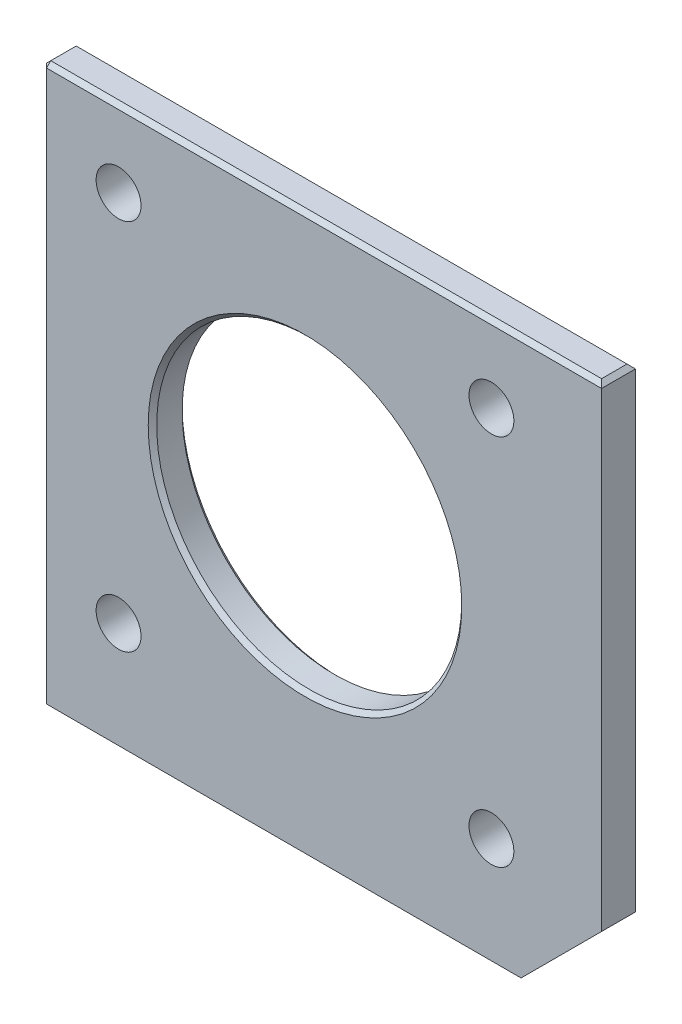
from build123d import *

# Parameters (mm, degrees)
ESQUISSE1_W        = 66
ESQUISSE1_H        = 66
ESQUISSE1_R        = 18
BOSS_EXTRU_1_DEPTH = 4
CHANFREIN1_SIZE    = 10
CHANFREIN2_SIZE    = 0.5
D_GAGEMENT_M51_D   = 5.3


with BuildPart() as part:
    # Esquisse1 → Boss.-Extru.1 (new body)
    with BuildSketch(Plane.XY):
        Rectangle(ESQUISSE1_W, ESQUISSE1_H)
        with Locations((-2, 2)):
            Circle(ESQUISSE1_R, mode=Mode.SUBTRACT)
    extrude(amount=BOSS_EXTRU_1_DEPTH)

    # Chanfrein1
    chanfrein1_edges = [part.edges().sort_by_distance(p)[0] for p in [
        (33, -33, 2),
    ]]
    chamfer(chanfrein1_edges, length=CHANFREIN1_SIZE)

    # Chanfrein2
    chanfrein2_edges = [part.edges().sort_by_distance(p)[0] for p in [
        (-33, 0, 4),
        (-33, -33, 2),
        (-33, 0, 0),
        (33, 33, 2),
        (0, 33, 4),
        (-33, 33, 2),
        (0, 33, 0),
        (-20, 2, 0),
        (-20, 2, 4),
        (-5, -33, 0),
        (-5, -33, 4),
    ]]
    chamfer(chanfrein2_edges, length=CHANFREIN2_SIZE)

    # Dégagement M51 (through all)
    with Locations(Plane.XY.offset(4)):
        with Locations((-24, 24), (20, 24), (20, -20), (-24, -20), (-162.098619818, 40.106243937), (-166.138996893, 40.106243937)):
            Hole(D_GAGEMENT_M51_D / 2)


solid = part.part
